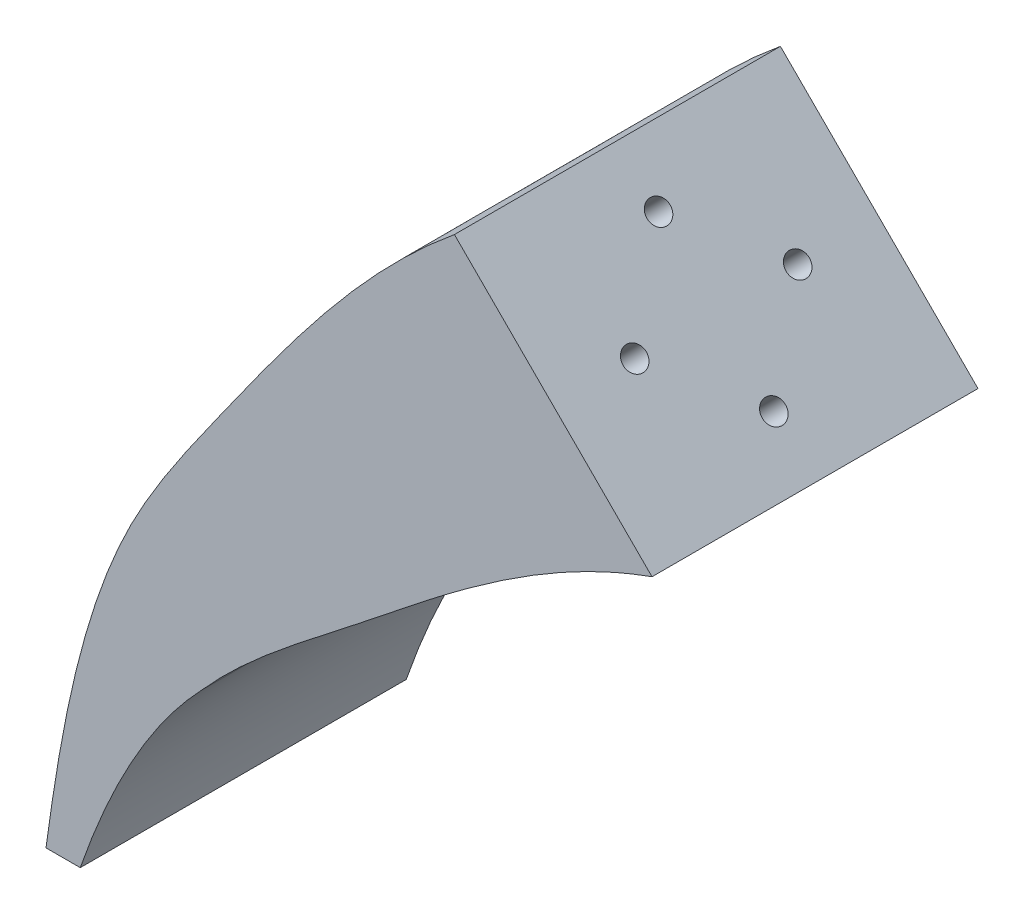
from build123d import *

# Parameters (mm, degrees)
BOSS_EXTRUDE1_DEPTH = 28
SKETCH2_R           = 1
CUT_EXTRUDE1_DEPTH  = 8


with BuildPart() as part:
    # Sketch1 → Boss-Extrude1 (new body)
    with BuildSketch(Plane.XY):
        with BuildLine():
            Line((2.091427576, 20.661862086), (19.061990324, 3.691299338))
            add(Edge.make_bspline(
                [(19.061990324, 3.691299338), (12.022648732, 1.181374363), (3.606718166, -4.502881384), (-8.768521596, -14.578433411), (-15.710250584, -19.650895957), (-19.63487909, -24.098483284)],
                knots=[0, 0, 0, 0, 0.463104191, 0.631300778, 1, 1, 1, 1], degree=3))
            add(Edge.make_bspline(
                [(-19.63487909, -24.098483284), (-25.969562098, -30.737294566), (-30.045502317, -42.502143037)],
                knots=[0, 0, 0, 1, 1, 1], degree=2))
            Line((-30.045502317, -42.502143037), (-32.987873718, -42.502143037))
            add(Edge.make_bspline(
                [(2.091427576, 20.661862086), (-6.153665282, 13.902778077), (-14.884492863, 1.613682443), (-29.203935151, -18.642558282), (-31.728248971, -33.20873178), (-32.987873718, -42.502143037)],
                knots=[0, 0, 0, 0, 0.426775149, 0.611805153, 1, 1, 1, 1], degree=3))
        make_face()
    extrude(amount=BOSS_EXTRUDE1_DEPTH)

    # Sketch2 → Cut-Extrude1 (cut)
    with BuildSketch(Plane(origin=(11.376644831, 11.376644831, 0), x_dir=(0, 0, -1), z_dir=(0.7071067811865388, 0.7071067811865562, 0))):
        with Locations(Location((-7, 1.131280172, 0), (0, 0, 90))):
            Circle(SKETCH2_R)
        with Locations(Location((-14, 8.131280172, 0), (0, 0, 270))):
            Circle(SKETCH2_R)
        with Locations(Location((-14, -5.868719828, 0), (0, 0, 90))):
            Circle(SKETCH2_R)
        with Locations(Location((-21, 1.131280172, 0), (0, 0, 270))):
            Circle(SKETCH2_R)
    extrude(amount=-CUT_EXTRUDE1_DEPTH, mode=Mode.SUBTRACT)


solid = part.part
